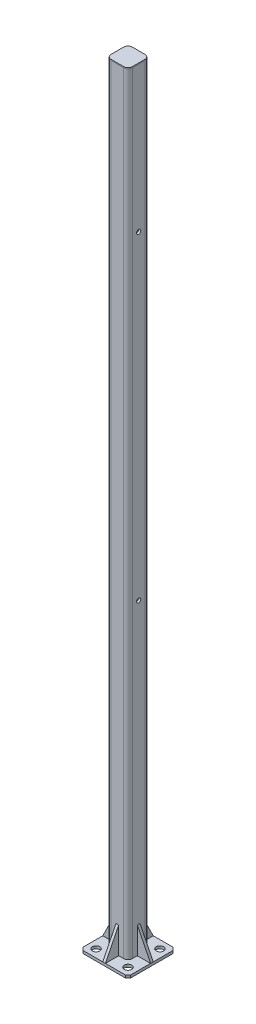
from build123d import *

# Parameters (mm, degrees)
MEMBER_1_DEPTH      = 1450
SKETCH_3_W          = 90
SKETCH_3_H          = 90
SKETCH_3_R          = 7
EXTRUDE_1_DEPTH     = 5
CHAMFER_1_SIZE      = 5
EXTRUDE_2_DEPTH     = 2
SKETCH_5_R          = 4
CUT_EXTRUDE_1_DEPTH = 1455.150611182
EXTRUDE_3_DEPTH     = 2.5
EXTRUDE_3_2_DEPTH   = 2.5
EXTRUDE_4_DEPTH     = 2.5
EXTRUDE_4_2_DEPTH   = 2.5


with BuildPart() as part:
    # Sketch1 → Member 1 (new body)
    with BuildSketch(Plane(origin=(0, 0, 0), x_dir=(-1, 0, 0), z_dir=(0, 1, 0))):
        with BuildLine():
            Line((-12, -20), (12, -20))
            ThreePointArc((12, -20), (17.656854249, -17.656854249), (20, -12))
            Line((20, -12), (20, 12))
            ThreePointArc((20, 12), (17.656854249, 17.656854249), (12, 20))
            Line((12, 20), (-12, 20))
            ThreePointArc((-12, 20), (-17.656854249, 17.656854249), (-20, 12))
            Line((-20, 12), (-20, -12))
            ThreePointArc((-20, -12), (-17.656854249, -17.656854249), (-12, -20))
        make_face()
        with BuildLine():
            Line((-12, -16), (12, -16))
            ThreePointArc((12, -16), (14.828427125, -14.828427125), (16, -12))
            Line((16, -12), (16, 12))
            ThreePointArc((16, 12), (14.828427125, 14.828427125), (12, 16))
            Line((12, 16), (-12, 16))
            ThreePointArc((-12, 16), (-14.828427125, 14.828427125), (-16, 12))
            Line((-16, 12), (-16, -12))
            ThreePointArc((-16, -12), (-14.828427125, -14.828427125), (-12, -16))
        make_face(mode=Mode.SUBTRACT)
    extrude(amount=MEMBER_1_DEPTH)

    # 草图5 → 切除-拉伸1 (cut, through all)
    with BuildSketch(Plane.ZY.offset(20)):
        with Locations((0, -23)):
            Circle(SKETCH_5_R)
        with Locations((0, 577)):
            Circle(SKETCH_5_R)
        with Locations((0, 1177)):
            Circle(SKETCH_5_R)
    extrude(amount=-CUT_EXTRUDE_1_DEPTH, mode=Mode.SUBTRACT)


with BuildPart() as body_2:
    # 草图3 → 凸台-拉伸1 (new body)
    with BuildSketch(Plane.XZ):
        Rectangle(SKETCH_3_W, SKETCH_3_H)
        with Locations(Location((30, 30, 0), (0, 0, 270))):
            Circle(SKETCH_3_R, mode=Mode.SUBTRACT)
        with Locations(Location((30, -30, 0), (0, 0, 90))):
            Circle(SKETCH_3_R, mode=Mode.SUBTRACT)
        with Locations(Location((-30, 30, 0), (0, 0, 90))):
            Circle(SKETCH_3_R, mode=Mode.SUBTRACT)
        with Locations(Location((-30, -30, 0), (0, 0, 270))):
            Circle(SKETCH_3_R, mode=Mode.SUBTRACT)
    extrude(amount=EXTRUDE_1_DEPTH)

    # 倒角1
    chamfer_1_edges = [body_2.edges().sort_by_distance(p)[0] for p in [
        (-45, -2.5, 45),
        (45, -2.5, 45),
        (45, -2.5, -45),
        (-45, -2.5, -45),
    ]]
    chamfer(chamfer_1_edges, length=CHAMFER_1_SIZE)


with BuildPart() as body_3:
    # 草图4 → 凸台-拉伸2 (new body)
    with BuildSketch(Plane(origin=(0, 1450, 0), x_dir=(1, 0, 0), z_dir=(0, 1, 0))):
        with BuildLine():
            Line((-12, -20), (12, -20))
            ThreePointArc((12, -20), (17.656854249, -17.656854249), (20, -12))
            Line((20, -12), (20, 12))
            ThreePointArc((20, 12), (17.656854249, 17.656854249), (12, 20))
            Line((12, 20), (-12, 20))
            ThreePointArc((-12, 20), (-17.656854249, 17.656854249), (-20, 12))
            Line((-20, 12), (-20, -12))
            ThreePointArc((-20, -12), (-17.656854249, -17.656854249), (-12, -20))
        make_face()
    extrude(amount=EXTRUDE_2_DEPTH)


with BuildPart() as body_4:
    # 草图6 → 凸台-拉伸3 (new, symmetric)
    with BuildSketch(Plane.XY):
        Polygon((20, 0), (20, 50), (45, 0), align=None)
    extrude(amount=EXTRUDE_3_DEPTH, both=True)


with BuildPart() as body_5:
    # 草图6 → Extrude 3 2 (new, symmetric)
    with BuildSketch(Plane.XY):
        Polygon((-45, 0), (-20, 0), (-20, 50), align=None)
    extrude(amount=EXTRUDE_3_2_DEPTH, both=True)


with BuildPart() as body_6:
    # 草图7 → 凸台-拉伸4 (new, symmetric)
    with BuildSketch(Plane(origin=(0, 0, 0), x_dir=(0, 0, -1), z_dir=(1, 0, 0))):
        Polygon((20, 50), (20, 0), (45, 0), align=None)
    extrude(amount=EXTRUDE_4_DEPTH, both=True)


with BuildPart() as body_7:
    # 草图7 → Extrude 4 2 (new, symmetric)
    with BuildSketch(Plane(origin=(0, 0, 0), x_dir=(0, 0, -1), z_dir=(1, 0, 0))):
        Polygon((-45, 0), (-20, 50), (-20, 0), align=None)
    extrude(amount=EXTRUDE_4_2_DEPTH, both=True)


solid = Compound([part.part, body_2.part, body_3.part, body_4.part, body_5.part, body_6.part, body_7.part])
